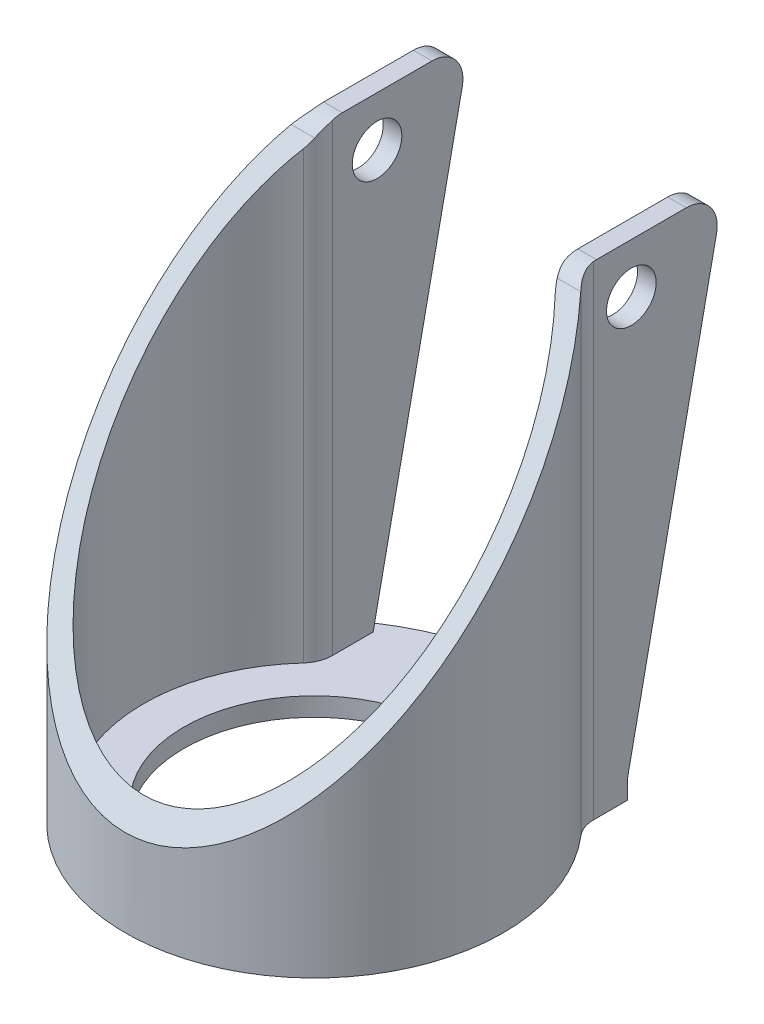
from build123d import *

# Parameters (mm, degrees)
SKETCH1_R               = 30.5
BOSS_EXTRUDE1_DEPTH     = 3
CUT_EXTRUDE1_DEPTH      = 95.663789341
CUT_EXTRUDE1_DEPTH_BACK = 95.663789341
SKETCH10_R              = 4
CUT_EXTRUDE2_DEPTH      = 104.861605143
SKETCH11_R              = 21
CUT_EXTRUDE3_DEPTH      = 93.207554018
FILLET1_R               = 5
FILLET2_R               = 5
FILLET3_R               = 5


with BuildPart() as part:
    # Sketch1 → Boss-Extrude1 (new body)
    with BuildSketch(Plane(origin=(0, 0, 0), x_dir=(1, 0, 0), z_dir=(0, 1, 0))):
        Circle(SKETCH1_R)
        with BuildLine():
            Line((22, 21.124630174), (22, 28.495613698))
            ThreePointArc((22, 28.495613698), (0, 36), (-22, 28.495613698))
            Line((-22, 28.495613698), (-22, 21.124630174))
            ThreePointArc((-22, 21.124630174), (0, 30.5), (22, 21.124630174))
        make_face()
    extrude(amount=BOSS_EXTRUDE1_DEPTH)

    # Sketch2 → Loft1 section 0
    with BuildSketch(Plane(origin=(0, 3, 0), x_dir=(1, 0, 0), z_dir=(0, 1, 0))):
        with BuildLine():
            Line((-22, 21.124630174), (-22, 28.495613698))
            Line((-22, 28.495613698), (-19, 28.495613698))
            Line((-19, 28.495613698), (-19, 19.880895352))
            ThreePointArc((-19, 19.880895352), (0, -27.5), (19, 19.880895352))
            Line((19, 19.880895352), (19, 28.495613698))
            Line((19, 28.495613698), (22, 28.495613698))
            Line((22, 28.495613698), (22, 21.124630174))
            ThreePointArc((22, 21.124630174), (0, -30.5), (-22, 21.124630174))
        make_face()
    # Sketch3 → Loft1 section 1
    with BuildSketch(Plane(origin=(0, 78, 0), x_dir=(1, 0, 0), z_dir=(0, 1, 0))):
        with BuildLine():
            Line((-22, 21.124630174), (-22, 44.124630174))
            Line((-22, 44.124630174), (-19, 44.124630174))
            Line((-19, 44.124630174), (-19, 19.880895352))
            ThreePointArc((-19, 19.880895352), (0, -27.5), (19, 19.880895352))
            Line((19, 19.880895352), (19, 44.124630174))
            Line((19, 44.124630174), (22, 44.124630174))
            Line((22, 44.124630174), (22, 21.124630174))
            ThreePointArc((22, 21.124630174), (0, -30.5), (-22, 21.124630174))
        make_face()
    loft()

    # Sketch9 → Cut-Extrude1 (cut, two sides: drawn at the far end of the back side and taken through both)
    with BuildSketch(Plane(origin=(0, 0, 0), x_dir=(0, 0, -1), z_dir=(1, 0, 0)).offset(-CUT_EXTRUDE1_DEPTH_BACK)):
        Polygon((-30.5, 14), (21.124630174, 78), (-30.5, 78), align=None)
    extrude(amount=CUT_EXTRUDE1_DEPTH + CUT_EXTRUDE1_DEPTH_BACK, mode=Mode.SUBTRACT)

    # Sketch10 → Cut-Extrude2 (cut, through all)
    with BuildSketch(Plane.ZY.offset(22)):
        with Locations((-29.124630174, 70)):
            Circle(SKETCH10_R)
    extrude(amount=-CUT_EXTRUDE2_DEPTH, mode=Mode.SUBTRACT)

    # Sketch11 → Cut-Extrude3 (cut, through all)
    with BuildSketch(Plane(origin=(0, 3, 0), x_dir=(1, 0, 0), z_dir=(0, 1, 0))):
        with Locations(Location((0, 0, 0), (0, 0, 270))):
            Circle(SKETCH11_R)
    extrude(amount=-CUT_EXTRUDE3_DEPTH, mode=Mode.SUBTRACT)

    # Fillet1
    fillet1_edges = [part.edges().sort_by_distance(p)[0] for p in [
        (-20.5, 78, -44.124630174),
        (20.5, 78, -44.124630174),
    ]]
    fillet(fillet1_edges, radius=FILLET1_R)

    # Fillet2
    fillet2_edges = [part.edges().sort_by_distance(p)[0] for p in [
        (-20.5, 78, -21.124630174),
        (20.5, 78, -21.124630174),
    ]]
    fillet(fillet2_edges, radius=FILLET2_R)

    # Fillet3
    fillet3_edges = [part.edges().sort_by_distance(p)[0] for p in [
        (19, 39.716879031, -19.880895352),
        (-19, 39.716879031, -19.880895352),
        (22, 38.695702002, -21.124630174),
        (-22, 38.695702002, -21.124630174),
    ]]
    fillet(fillet3_edges, radius=FILLET3_R)


solid = part.part
